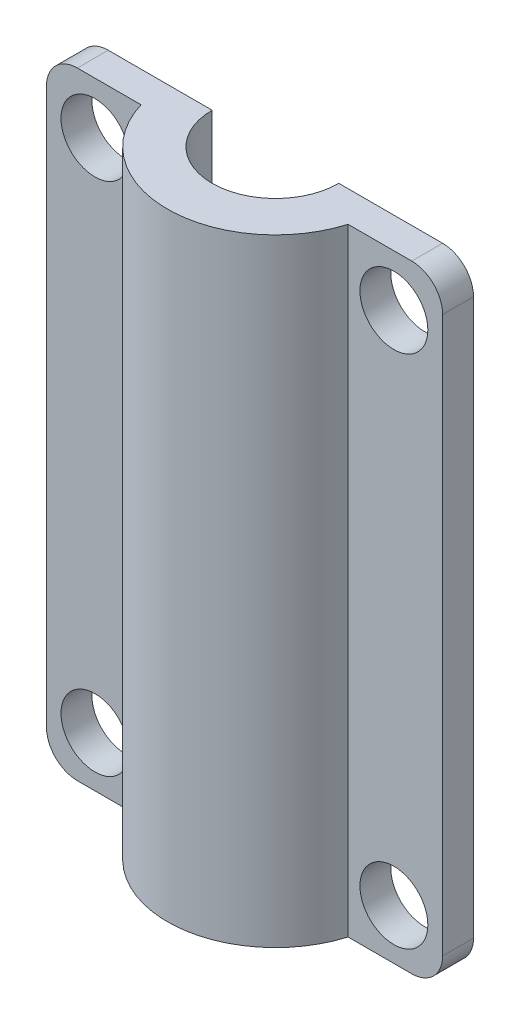
from build123d import *

# Parameters (mm, degrees)
EXTRUDE_1_DEPTH          = 20
CUT_EXTRUDE_1_DEPTH      = 83.680748207
CUT_EXTRUDE_1_DEPTH_BACK = 83.680748207
SKETCH_2_R               = 1.1
FILLET_1_R               = 1


with BuildPart() as part:
    # 草图1 → 凸台-拉伸1 (new body)
    with BuildSketch(Plane(origin=(0, 0, 0), x_dir=(1, 0, 0), z_dir=(0, 1, 0))):
        with BuildLine():
            Line((67.351218567, -14.287180049), (67.351218567, -15.287180049))
            Line((67.351218567, -15.287180049), (70.414699146, -15.287180049))
            ThreePointArc((70.414699146, -15.287180049), (73.768801112, -17.787180049), (77.122903079, -15.287180049))
            Line((77.122903079, -15.287180049), (80.186383657, -15.287180049))
            Line((80.186383657, -15.287180049), (80.186383657, -14.287180049))
            Line((80.186383657, -14.287180049), (75.823885018, -14.287180049))
            ThreePointArc((75.823885018, -14.287180049), (73.771343065, -16.339722002), (71.718801112, -14.287180049))
            Line((71.718801112, -14.287180049), (67.351218567, -14.287180049))
        make_face()
    extrude(amount=EXTRUDE_1_DEPTH)

    # 草图2 → 切除-拉伸1 (cut, two sides: drawn at the far end of the back side and taken through both)
    with BuildSketch(Plane.XY.offset(15.287180049).offset(-CUT_EXTRUDE_1_DEPTH_BACK)):
        with Locations((68.921019173, 18.327295742)):
            Circle(SKETCH_2_R)
        with Locations((68.921019173, 1.629689565)):
            Circle(SKETCH_2_R)
        with Locations((78.60655426, 18.327295742)):
            Circle(SKETCH_2_R)
        with Locations((78.60655426, 1.629689565)):
            Circle(SKETCH_2_R)
    extrude(amount=CUT_EXTRUDE_1_DEPTH + CUT_EXTRUDE_1_DEPTH_BACK, mode=Mode.SUBTRACT)

    # 圆角1
    fillet_1_edges = [part.edges().sort_by_distance(p)[0] for p in [
        (80.186383657, 20, 14.787180049),
        (67.351218567, 20, 14.787180049),
        (67.351218567, 0, 14.787180049),
        (80.186383657, 0, 14.787180049),
    ]]
    fillet(fillet_1_edges, radius=FILLET_1_R)


solid = part.part
